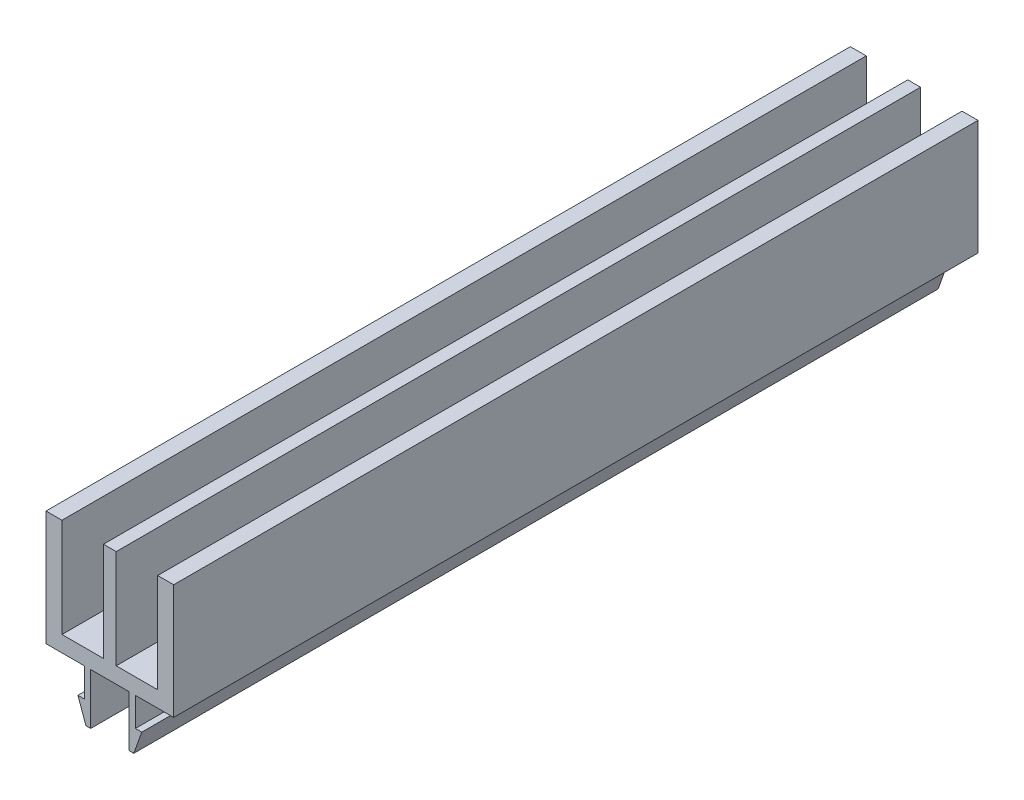
from build123d import *

# Parameters (mm, degrees)
BOSS_EXTRU_1_DEPTH = 126


with BuildPart() as part:
    # Esquisse1 → Boss.-Extru.1 (new body)
    with BuildSketch(Plane.XY.offset(50)):
        Polygon((-1, 2.5), (-7.5, 2.5), (-7.5, 17.999999998), (-10, 17.999999998), (-10, 0), (-4, 0), (-4, -4.5), (-5, -4.5), (-3.75, -8), (-3, -8), (-3, 0), (3, 0), (3, -8), (3.75, -8), (5, -4.5), (4, -4.5), (4, 0), (10, 0), (10, 17.999999998), (7.5, 17.999999998), (7.5, 2.5), (1, 2.5), (1, 17.999999998), (-1, 17.999999998), align=None)
    extrude(amount=-BOSS_EXTRU_1_DEPTH)


solid = part.part
